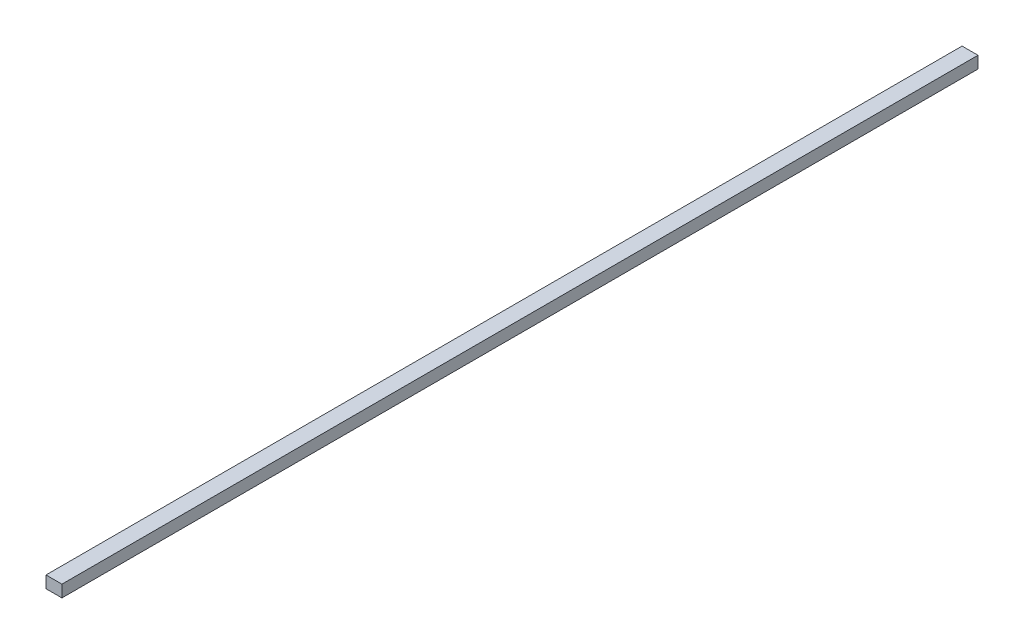
from build123d import *

# Parameters (mm, degrees)
SKETCH1_W           = 4
SKETCH1_H           = 230
BOSS_EXTRUDE1_DEPTH = 3


with BuildPart() as part:
    # Sketch1 → Boss-Extrude1 (new body)
    with BuildSketch(Plane(origin=(0, 0, 0), x_dir=(1, 0, 0), z_dir=(0, 1, 0))):
        Rectangle(SKETCH1_W, SKETCH1_H)
    extrude(amount=BOSS_EXTRUDE1_DEPTH)


solid = part.part
